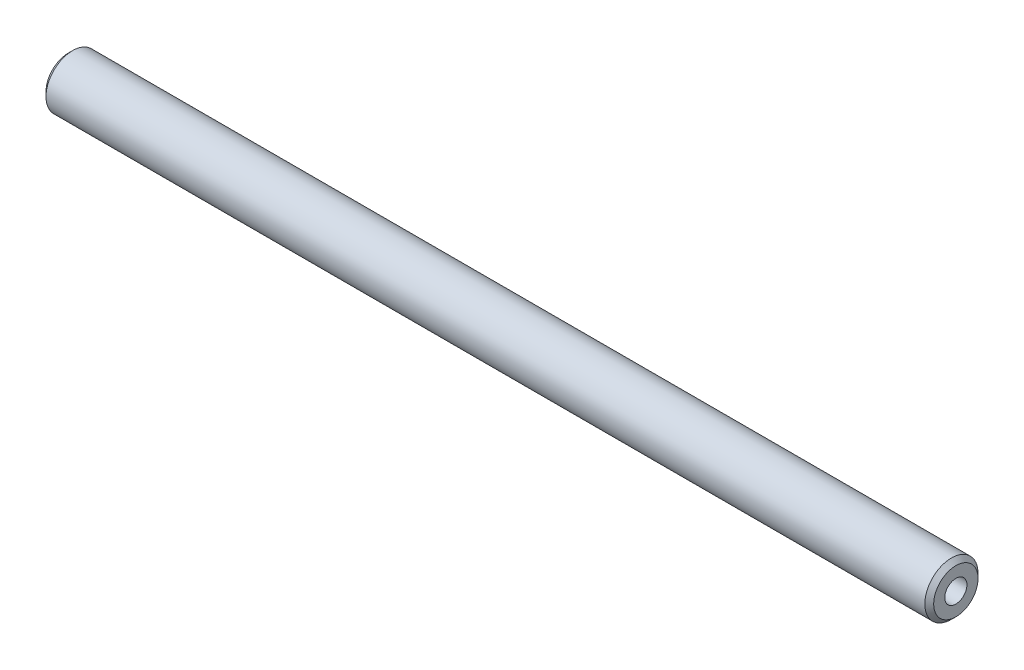
from build123d import *

# Parameters (mm, degrees)
SKETCH1_W          = 100
SKETCH1_H          = 3
TAPPED_HOLE1_D     = 2.5
TAPPED_HOLE1_DEPTH = 8.5
TAPPED_HOLE1_TIP   = 0.751075774
TAPPED_HOLE2_D     = 2.5
TAPPED_HOLE2_DEPTH = 8.5
TAPPED_HOLE2_TIP   = 0.751075774
CHAMFER1_SIZE      = 0.5


with BuildPart() as part:
    # Sketch1 → Revolve1 (revolve)
    with BuildSketch(Plane.XY):
        with Locations((50, 1.5)):
            Rectangle(SKETCH1_W, SKETCH1_H)
    revolve(axis=Axis((0, 0, 0), (1, 0, 0)))

    # Tapped Hole1
    with Locations(Plane.ZY):
        with Locations((0, 0)):
            Hole(TAPPED_HOLE1_D / 2, depth=TAPPED_HOLE1_DEPTH)
            with Locations((0, 0, -(TAPPED_HOLE1_DEPTH + TAPPED_HOLE1_TIP / 2))):  # 118° drill point
                Cone(0, TAPPED_HOLE1_D / 2, TAPPED_HOLE1_TIP, mode=Mode.SUBTRACT)

    # Tapped Hole2
    with Locations(Plane(origin=(100, 0, 0), x_dir=(0, 0, -1), z_dir=(1, 0, 0))):
        with Locations((0, 0)):
            Hole(TAPPED_HOLE2_D / 2, depth=TAPPED_HOLE2_DEPTH)
            with Locations((0, 0, -(TAPPED_HOLE2_DEPTH + TAPPED_HOLE2_TIP / 2))):  # 118° drill point
                Cone(0, TAPPED_HOLE2_D / 2, TAPPED_HOLE2_TIP, mode=Mode.SUBTRACT)

    # Chamfer1
    chamfer1_edges = [part.edges().sort_by_distance(p)[0] for p in [
        (0, -3, 0),
        (100, -3, 0),
    ]]
    chamfer(chamfer1_edges, length=CHAMFER1_SIZE)


solid = part.part
